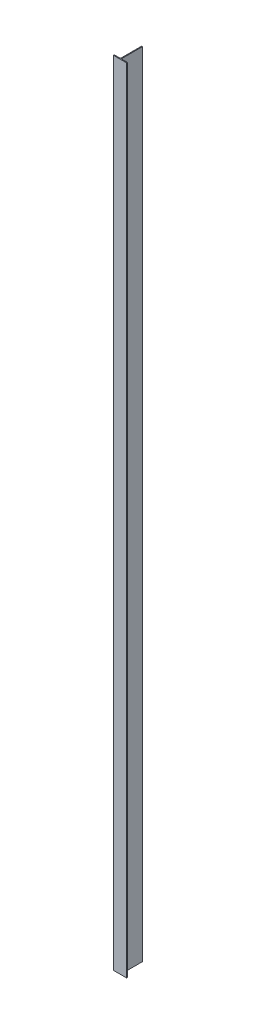
from build123d import *

# Parameters (mm, degrees)
STORE_SOVE_ORTA_1_START = 182.5
STORE_SOVE_ORTA_1_DEPTH = 1427.5


with BuildPart() as part:
    # Sketch1 → STORE_sove_orta_1 (new body)
    with BuildSketch(Plane(origin=(0, 0, 0), x_dir=(1, 0, 0), z_dir=(0, 1, 0)).offset(STORE_SOVE_ORTA_1_START)):
        Polygon((690, -40), (690, -38.5), (701.25, -38.5), (701.25, 0), (702.75, 0), (702.75, -38.5), (714, -38.5), (714, -40), align=None)
    extrude(amount=STORE_SOVE_ORTA_1_DEPTH)


solid = part.part
